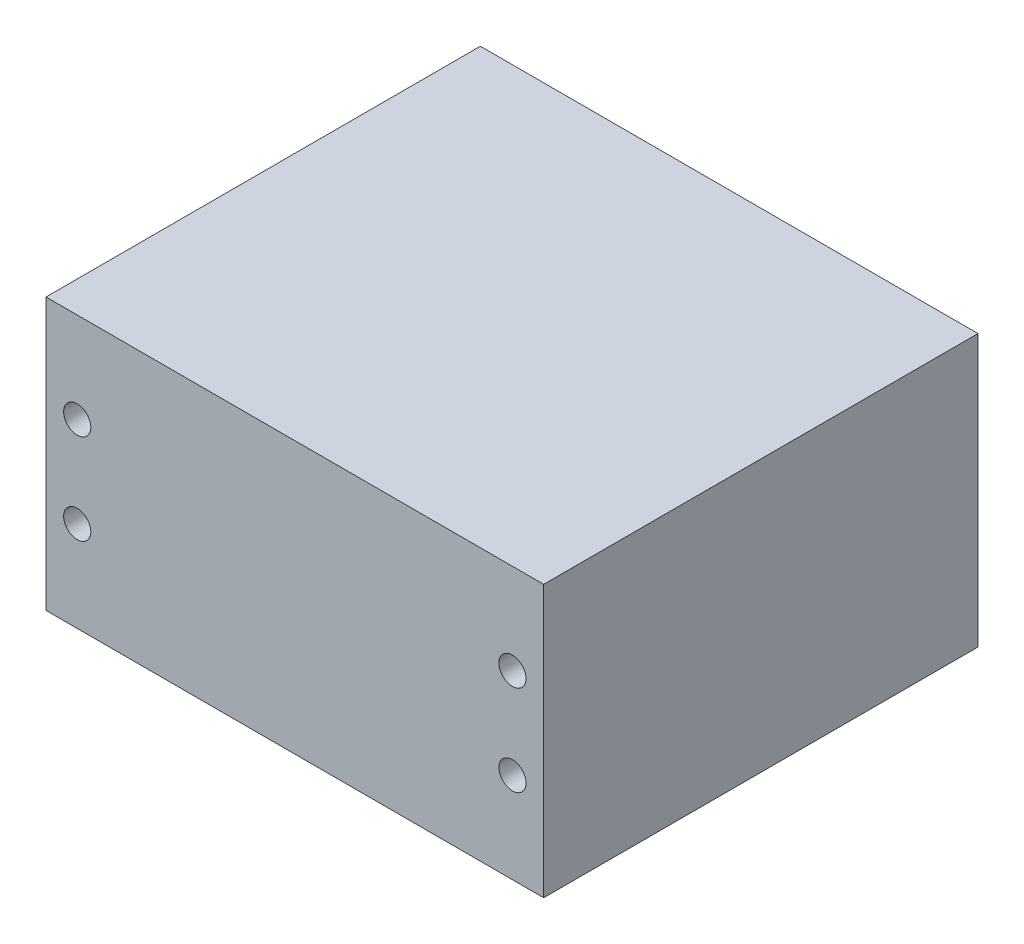
from build123d import *

# Parameters (mm, degrees)
SKETCH1_W           = 55
SKETCH1_H           = 30
SKETCH1_R           = 1.5
BOSS_EXTRUDE1_DEPTH = 48


with BuildPart() as part:
    # Sketch1 → Boss-Extrude1 (new body)
    with BuildSketch(Plane.XY):
        Rectangle(SKETCH1_W, SKETCH1_H)
        with Locations((24.05, 5)):
            Circle(SKETCH1_R, mode=Mode.SUBTRACT)
        with Locations((24.05, -5)):
            Circle(SKETCH1_R, mode=Mode.SUBTRACT)
        with Locations(Location((-24.05, -5, 0), (0, 0, 180))):
            Circle(SKETCH1_R, mode=Mode.SUBTRACT)
        with Locations(Location((-24.05, 5, 0), (0, 0, 180))):
            Circle(SKETCH1_R, mode=Mode.SUBTRACT)
    extrude(amount=BOSS_EXTRUDE1_DEPTH)


solid = part.part
